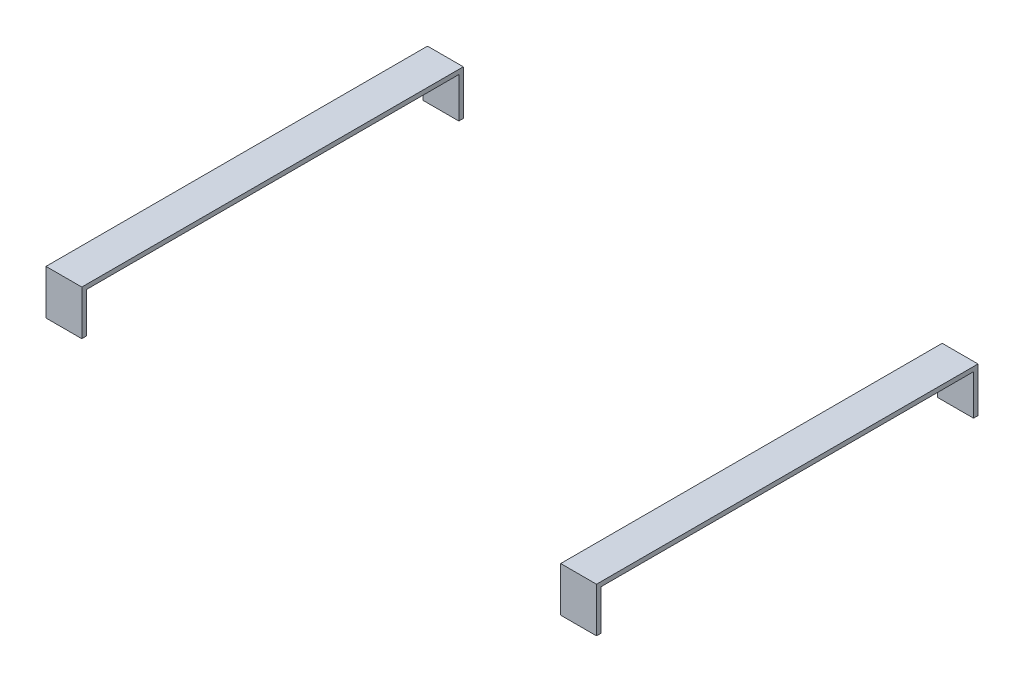
from build123d import *

# Parameters (mm, degrees)
CROQUIS1_W                = 80
CROQUIS1_H                = 10
SALIENTE_EXTRUIR1_DEPTH   = 100
SALIENTE_EXTRUIR1_2_DEPTH = 100
SALIENTE_EXTRUIR1_3_DEPTH = 100
SALIENTE_EXTRUIR1_4_DEPTH = 100
CROQUIS2_W                = 80
CROQUIS2_H                = 10
SALIENTE_EXTRUIR2_DEPTH   = 832.4


with BuildPart() as part:
    # Croquis1 → Saliente-Extruir1 (new body)
    with BuildSketch(Plane(origin=(0, 0, 0), x_dir=(1, 0, 0), z_dir=(0, 1, 0))):
        with Locations((-40, -5)):
            Rectangle(CROQUIS1_W, CROQUIS1_H)
    extrude(amount=SALIENTE_EXTRUIR1_DEPTH)



with BuildPart() as body_2:
    # Croquis1 → Saliente-Extruir1 2 (new body)
    with BuildSketch(Plane(origin=(0, 0, 0), x_dir=(1, 0, 0), z_dir=(0, 1, 0))):
        with Locations((1110, -5)):
            Rectangle(CROQUIS1_W, CROQUIS1_H)
    extrude(amount=SALIENTE_EXTRUIR1_2_DEPTH)


with BuildPart() as body_3:
    # Croquis1 → Saliente-Extruir1 3 (new body)
    with BuildSketch(Plane(origin=(0, 0, 0), x_dir=(1, 0, 0), z_dir=(0, 1, 0))):
        with Locations((1110, -847.4)):
            Rectangle(CROQUIS1_W, CROQUIS1_H)
    extrude(amount=SALIENTE_EXTRUIR1_3_DEPTH)


with BuildPart() as body_4:
    # Croquis1 → Saliente-Extruir1 4 (new body)
    with BuildSketch(Plane(origin=(0, 0, 0), x_dir=(1, 0, 0), z_dir=(0, 1, 0))):
        with Locations((-40, -847.4)):
            Rectangle(CROQUIS1_W, CROQUIS1_H)
    extrude(amount=SALIENTE_EXTRUIR1_4_DEPTH)


with BuildPart() as part_1:
    add(part.part)

    add(body_2.part)  # Saliente-Extruir2 merges body 2

    add(body_3.part)  # Saliente-Extruir2 merges body 3

    add(body_4.part)  # Saliente-Extruir2 merges body 4
    # Croquis2 → Saliente-Extruir2 (add)
    with BuildSketch(Plane.XY.offset(10)):
        with Locations((-40, 95)):
            Rectangle(CROQUIS2_W, CROQUIS2_H)
        with Locations((1110, 95)):
            Rectangle(CROQUIS2_W, CROQUIS2_H)
    extrude(amount=SALIENTE_EXTRUIR2_DEPTH)


solid = part_1.part
